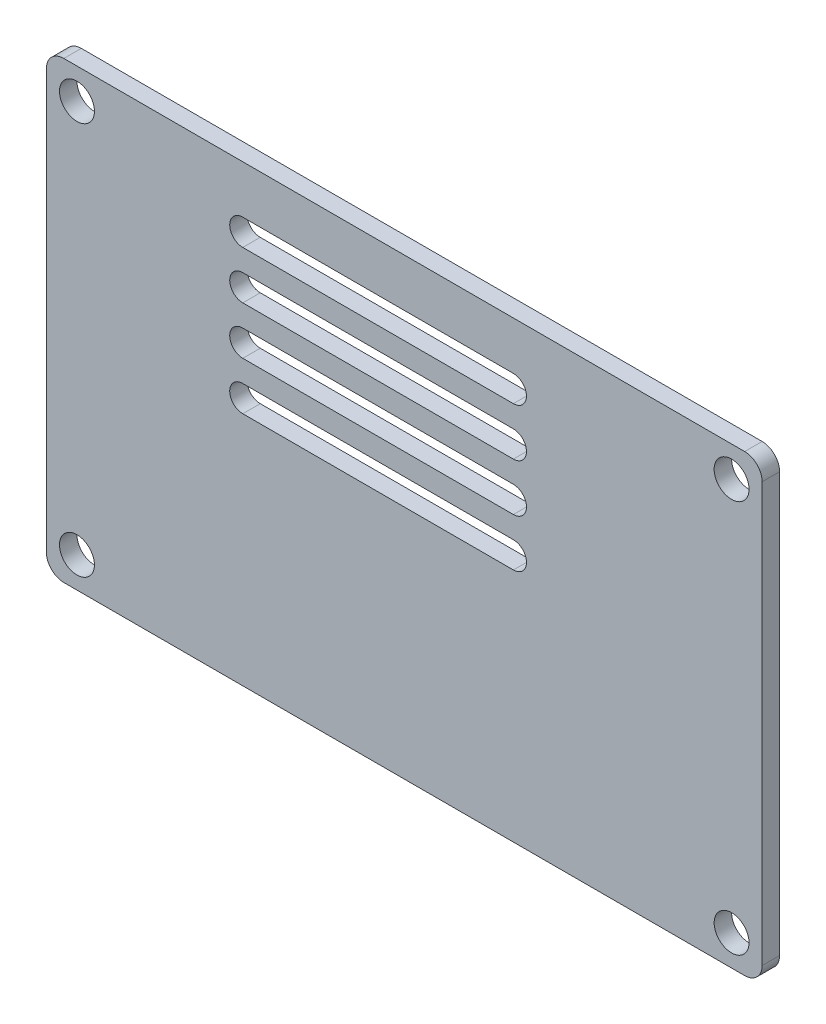
from build123d import *

# Parameters (mm, degrees)
SKETCH1_W           = 82
SKETCH1_H           = 52
BOSS_EXTRUDE1_DEPTH = 2
FILLET1_R           = 2
CUT_EXTRUDE1_DEPTH  = 49.590122453
SKETCH3_R           = 2
CUT_EXTRUDE2_DEPTH  = 49.590122453


with BuildPart() as part:
    # Sketch1 → Boss-Extrude1 (new body)
    with BuildSketch(Plane.XY):
        Rectangle(SKETCH1_W, SKETCH1_H)
    extrude(amount=BOSS_EXTRUDE1_DEPTH)

    # Fillet1
    fillet1_edges = [part.edges().sort_by_distance(p)[0] for p in [
        (-41, 26, 1),
        (41, 26, 1),
        (41, -26, 1),
        (-41, -26, 1),
    ]]
    fillet(fillet1_edges, radius=FILLET1_R)

    # Sketch2 → Cut-Extrude1 (cut, through all)
    with BuildSketch(Plane.XY.offset(2)):
        with BuildLine():
            Line((-18.5, 20.5), (12.5, 20.5))
            ThreePointArc((12.5, 20.5), (14, 19), (12.5, 17.5))
            Line((12.5, 17.5), (-18.5, 17.5))
            ThreePointArc((-18.5, 17.5), (-20, 19), (-18.5, 20.5))
        make_face()
        with BuildLine():
            Line((-18.5, 15), (12.5, 15))
            ThreePointArc((12.5, 15), (14, 13.5), (12.5, 12))
            Line((12.5, 12), (-18.5, 12))
            ThreePointArc((-18.5, 12), (-20, 13.5), (-18.5, 15))
        make_face()
        with BuildLine():
            Line((-18.5, 9.5), (12.5, 9.5))
            ThreePointArc((12.5, 9.5), (14, 8), (12.5, 6.5))
            Line((12.5, 6.5), (-18.5, 6.5))
            ThreePointArc((-18.5, 6.5), (-20, 8), (-18.5, 9.5))
        make_face()
        with BuildLine():
            Line((-18.5, 4), (12.5, 4))
            ThreePointArc((12.5, 4), (14, 2.5), (12.5, 1))
            Line((12.5, 1), (-18.5, 1))
            ThreePointArc((-18.5, 1), (-20, 2.5), (-18.5, 4))
        make_face()
    extrude(amount=-CUT_EXTRUDE1_DEPTH, mode=Mode.SUBTRACT)

    # Sketch3 → Cut-Extrude2 (cut, through all)
    with BuildSketch(Plane.XY.offset(2)):
        with Locations((37.5, 22.5)):
            Circle(SKETCH3_R)
        with Locations((-37.5, 22.5)):
            Circle(SKETCH3_R)
        with Locations((37.5, -22.5)):
            Circle(SKETCH3_R)
        with Locations((-37.5, -22.5)):
            Circle(SKETCH3_R)
    extrude(amount=-CUT_EXTRUDE2_DEPTH, mode=Mode.SUBTRACT)


solid = part.part
